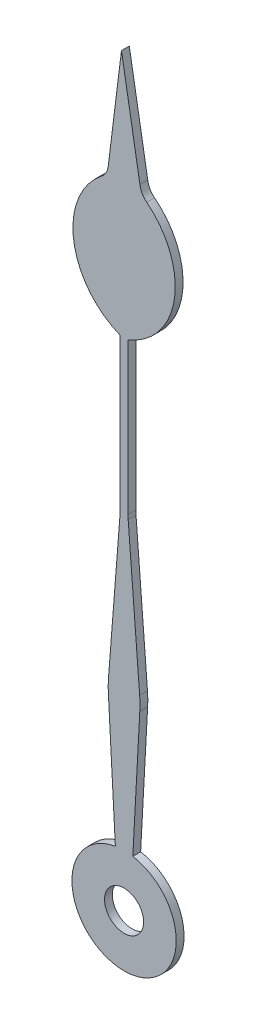
from build123d import *

# Parameters (mm, degrees)
SKETCH1_R           = 0.75
BOSS_EXTRUDE2_DEPTH = 0.3


with BuildPart() as part:
    # Sketch1 → Boss-Extrude2 (new body)
    with BuildSketch(Plane.XY):
        with BuildLine():
            Line((-0.334323817, 1.971858916), (-0.602966855, 6.919879094))
            ThreePointArc((-0.602966855, 6.919879094), (-0.608561245, 7.18473737), (-0.596611597, 7.449385078))
            Line((-0.596611597, 7.449385078), (-0.156118862, 13.067687454))
            ThreePointArc((-0.156118862, 13.067687454), (-0.151530301, 13.145790905), (-0.15, 13.224014062))
            Line((-0.15, 13.224014062), (-0.15, 19.026340954))
            ThreePointArc((-0.15, 19.026340954), (-1.930835311, 21.281447203), (-0.868120306, 23.951187906))
            ThreePointArc((-0.868120306, 23.951187906), (-0.691943741, 24.15713708), (-0.607202, 24.414570725))
            Line((-0.607202, 24.414570725), (-0.100615971, 28.506000973))
            Line((-0.100615971, 28.506000973), (0.607202, 24.414570725))
            ThreePointArc((0.607202, 24.414570725), (0.691943741, 24.15713708), (0.868120306, 23.951187906))
            ThreePointArc((0.868120306, 23.951187906), (1.930835311, 21.281447203), (0.15, 19.026340954))
            Line((0.15, 19.026340954), (0.15, 13.224014062))
            ThreePointArc((0.15, 13.224014062), (0.151530301, 13.145790905), (0.156118862, 13.067687454))
            Line((0.156118862, 13.067687454), (0.596611597, 7.449385078))
            ThreePointArc((0.596611597, 7.449385078), (0.608561245, 7.18473737), (0.602966855, 6.919879094))
            Line((0.602966855, 6.919879094), (0.334323817, 1.971858916))
            ThreePointArc((0.334323817, 1.971858916), (0, -2), (-0.334323817, 1.971858916))
        make_face()
        Circle(SKETCH1_R, mode=Mode.SUBTRACT)
    extrude(amount=BOSS_EXTRUDE2_DEPTH)


solid = part.part
